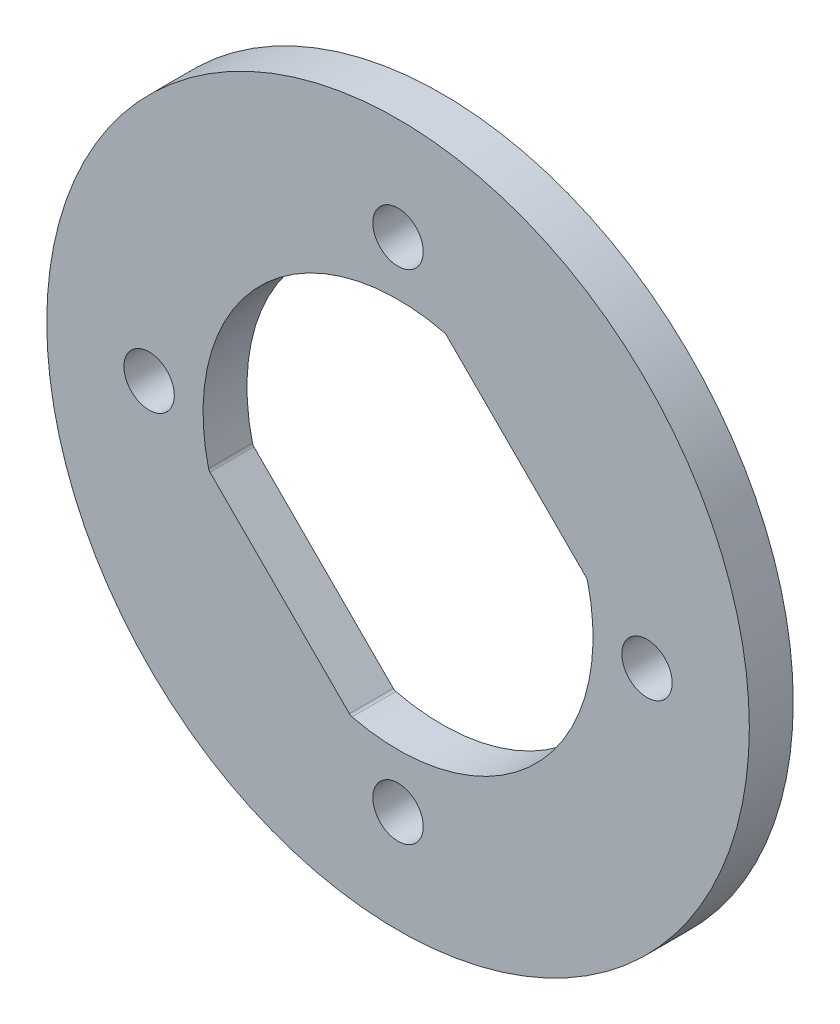
from build123d import *

# Parameters (mm, degrees)
SKETCH6_R           = 12.7
SKETCH6_R_2         = 0.9115
BOSS_EXTRUDE3_DEPTH = 1.5875


with BuildPart() as part:
    # Sketch6 → Boss-Extrude3 (new body)
    # profile 1 of 2: a face of its own
    with BuildSketch(Plane.XY):
        Circle(SKETCH6_R)
        with BuildLine():
            ThreePointArc((6.269554118, 8.885849209), (0, 10.875), (-6.269554118, 8.885849209))
            Line((-6.269554118, 8.885849209), (-5.055813485, 7.672108576))
            ThreePointArc((-5.055813485, 7.672108576), (-5.055813485, 5.055813485), (-7.672108576, 5.055813485))
            Line((-7.672108576, 5.055813485), (-8.885849209, 6.269554118))
            ThreePointArc((-8.885849209, 6.269554118), (-10.875, 0), (-8.885849209, -6.269554118))
            Line((-8.885849209, -6.269554118), (-7.672108576, -5.055813485))
            ThreePointArc((-7.672108576, -5.055813485), (-5.055813485, -5.055813485), (-5.055813485, -7.672108576))
            Line((-5.055813485, -7.672108576), (-6.269554118, -8.885849209))
            ThreePointArc((-6.269554118, -8.885849209), (0, -10.875), (6.269554118, -8.885849209))
            Line((6.269554118, -8.885849209), (5.055813485, -7.672108576))
            ThreePointArc((5.055813485, -7.672108576), (5.055813485, -5.055813485), (7.672108576, -5.055813485))
            Line((7.672108576, -5.055813485), (8.885849209, -6.269554118))
            ThreePointArc((8.885849209, -6.269554118), (10.875, 0), (8.885849209, 6.269554118))
            Line((8.885849209, 6.269554118), (7.672108576, 5.055813485))
            ThreePointArc((7.672108576, 5.055813485), (5.055813485, 5.055813485), (5.055813485, 7.672108576))
            Line((5.055813485, 7.672108576), (6.269554118, 8.885849209))
        make_face(mode=Mode.SUBTRACT)
    # profile 2 of 2: a face of its own
    with BuildSketch(Plane.XY):
        with BuildLine():
            Line((5.055813485, 7.672108576), (6.269554118, 8.885849209))
            ThreePointArc((6.269554118, 8.885849209), (0, 10.875), (-6.269554118, 8.885849209))
            Line((-6.269554118, 8.885849209), (-5.055813485, 7.672108576))
            ThreePointArc((-5.055813485, 7.672108576), (-5.055813485, 5.055813485), (-7.672108576, 5.055813485))
            Line((-7.672108576, 5.055813485), (-8.885849209, 6.269554118))
            ThreePointArc((-8.885849209, 6.269554118), (-10.875, 0), (-8.885849209, -6.269554118))
            Line((-8.885849209, -6.269554118), (-7.672108576, -5.055813485))
            ThreePointArc((-7.672108576, -5.055813485), (-5.055813485, -5.055813485), (-5.055813485, -7.672108576))
            Line((-5.055813485, -7.672108576), (-6.269554118, -8.885849209))
            ThreePointArc((-6.269554118, -8.885849209), (0, -10.875), (6.269554118, -8.885849209))
            Line((6.269554118, -8.885849209), (5.055813485, -7.672108576))
            ThreePointArc((5.055813485, -7.672108576), (5.055813485, -5.055813485), (7.672108576, -5.055813485))
            Line((7.672108576, -5.055813485), (8.885849209, -6.269554118))
            ThreePointArc((8.885849209, -6.269554118), (10.875, 0), (8.885849209, 6.269554118))
            Line((8.885849209, 6.269554118), (7.672108576, 5.055813485))
            ThreePointArc((7.672108576, 5.055813485), (5.055813485, 5.055813485), (5.055813485, 7.672108576))
        make_face()
        with Locations((0, 9.000000134)):
            Circle(SKETCH6_R_2, mode=Mode.SUBTRACT)
        with Locations((9.000000134, 0)):
            Circle(SKETCH6_R_2, mode=Mode.SUBTRACT)
        with Locations((0, -9.000000134)):
            Circle(SKETCH6_R_2, mode=Mode.SUBTRACT)
        with Locations((-9.000000134, 0)):
            Circle(SKETCH6_R_2, mode=Mode.SUBTRACT)
        with BuildLine():
            ThreePointArc((-1.663855614, -6.850845531), (4.985102807, -4.985102807), (6.850845531, 1.663855614))
            ThreePointArc((6.850845531, 1.663855614), (6.830865544, 1.714608205), (6.79791666, 1.758075393))
            Line((6.79791666, 1.758075393), (1.758075393, 6.79791666))
            ThreePointArc((1.758075393, 6.79791666), (1.714608205, 6.830865544), (1.663855614, 6.850845531))
            ThreePointArc((1.663855614, 6.850845531), (-4.985102807, 4.985102807), (-6.850845531, -1.663855614))
            ThreePointArc((-6.850845531, -1.663855614), (-6.830865544, -1.714608205), (-6.79791666, -1.758075393))
            Line((-6.79791666, -1.758075393), (-1.758075393, -6.79791666))
            ThreePointArc((-1.758075393, -6.79791666), (-1.714608205, -6.830865544), (-1.663855614, -6.850845531))
        make_face(mode=Mode.SUBTRACT)
    extrude(amount=BOSS_EXTRUDE3_DEPTH)


solid = part.part
